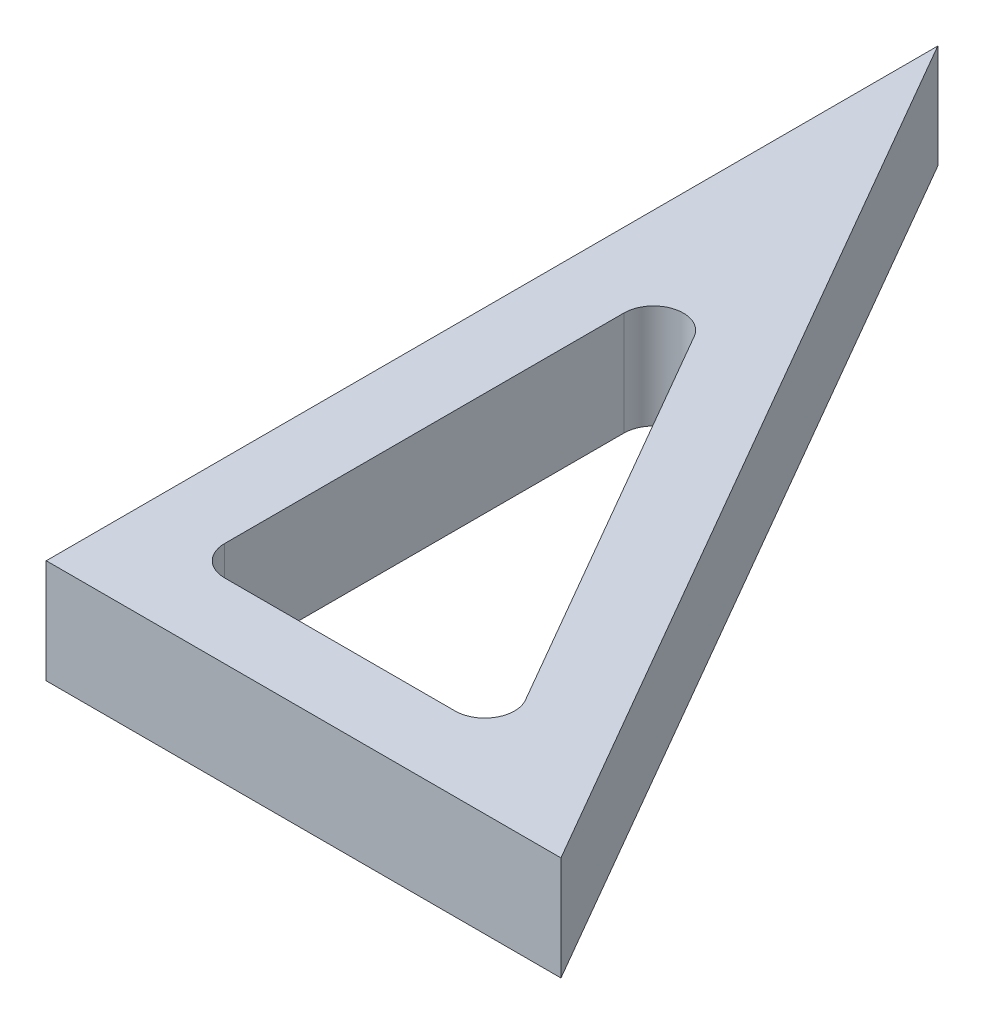
from build123d import *

# Parameters (mm, degrees)
BOSS_EXTRUDE1_DEPTH = 7


with BuildPart() as part:
    # Sketch1 → Boss-Extrude1 (new body)
    with BuildSketch(Plane(origin=(0, 0, 0), x_dir=(1, 0, 0), z_dir=(0, 1, 0))):
        Polygon((0, 0), (0, 60), (34.641016151, 0), align=None)
        with BuildLine():
            Line((5, 7), (5, 33.875644347))
            ThreePointArc((5, 33.875644347), (6.48236191, 35.807496), (8.732050808, 34.875644347))
            Line((8.732050808, 34.875644347), (24.248711306, 8))
            ThreePointArc((24.248711306, 8), (24.248711306, 6), (22.516660498, 5))
            Line((22.516660498, 5), (7, 5))
            ThreePointArc((7, 5), (5.585786438, 5.585786438), (5, 7))
        make_face(mode=Mode.SUBTRACT)
    extrude(amount=BOSS_EXTRUDE1_DEPTH)


solid = part.part
